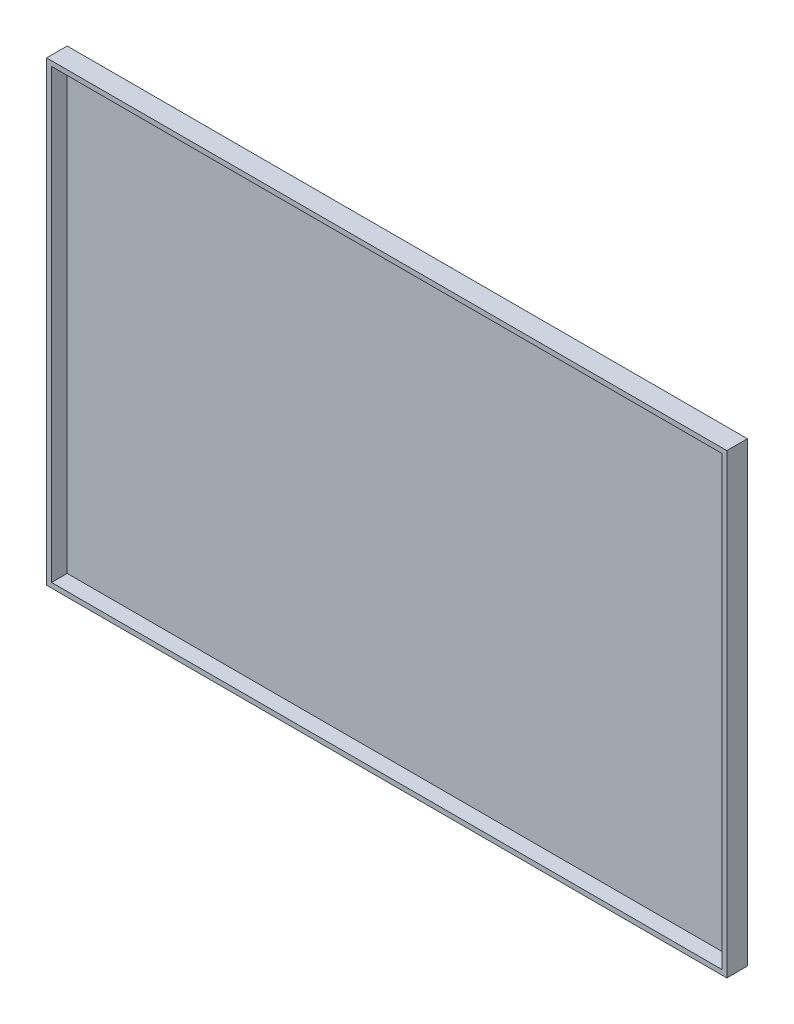
from build123d import *

# Parameters (mm, degrees)
ESQUISSE1_W             = 3044
ESQUISSE1_H             = 2044
BOSS_EXTRU_1_DEPTH      = 92
ESQUISSE2_W             = 3000
ESQUISSE2_H             = 2000
ENL_V_MAT_EXTRU_2_DEPTH = 70


with BuildPart() as part:
    # Esquisse1 → Boss.-Extru.1 (new body)
    with BuildSketch(Plane.XY):
        with Locations((-1719.278911565, 372.340136054)):
            Rectangle(ESQUISSE1_W, ESQUISSE1_H)
    extrude(amount=BOSS_EXTRU_1_DEPTH)

    # Esquisse2 → Enlèv. mat.-Extru.2 (cut)
    with BuildSketch(Plane.XY.offset(92)):
        with Locations((-1719.278911565, 372.340136054)):
            Rectangle(ESQUISSE2_W, ESQUISSE2_H)
    extrude(amount=-ENL_V_MAT_EXTRU_2_DEPTH, mode=Mode.SUBTRACT)


solid = part.part
